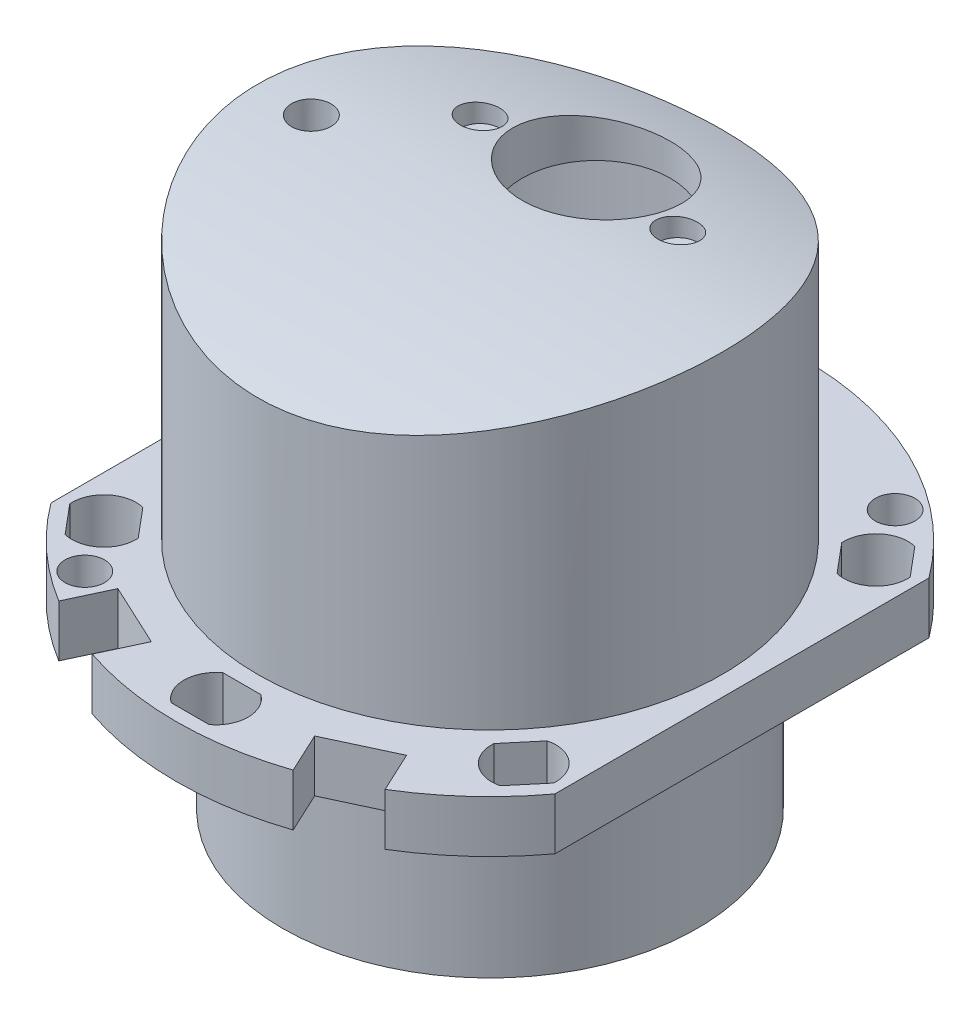
from build123d import *

# Parameters (mm, degrees)
BOSS_EXTRUDE1_DEPTH     = 5.25
CUT_EXTRUDE1_DEPTH      = 82.622208988
CUT_EXTRUDE1_DEPTH_BACK = 82.622208988
SKETCH2_R               = 4
SKETCH3_R               = 47
BOSS_EXTRUDE2_DEPTH     = 56.5
CUT_EXTRUDE4_DEPTH      = 103.213917839
CUT_EXTRUDE4_DEPTH_BACK = 103.213917839
SKETCH5_R               = 4
SKETCH5_R_2             = 15
CUT_EXTRUDE5_DEPTH      = 56.5
SKETCH6_R               = 42
BOSS_EXTRUDE3_DEPTH     = 36.5
CUT_EXTRUDE6_DEPTH      = 50.5
CUT_EXTRUDE6_DEPTH_BACK = 42.5
SKETCH7_R               = 39.5
SKETCH9_R               = 4.8
BOSS_EXTRUDE4_DEPTH     = 6
SKETCH10_R              = 2.2
CUT_EXTRUDE7_DEPTH      = 124.063743645
SKETCH11_R              = 4.8
CUT_EXTRUDE8_DEPTH      = 4
SKETCH12_R              = 4
CUT_EXTRUDE9_DEPTH      = 11
SKETCH13_R              = 3.5
CUT_EXTRUDE10_DEPTH     = 11.25


with BuildPart() as part:
    # Sketch1 → Boss-Extrude1 (new, symmetric)
    with BuildSketch(Plane(origin=(0, 0, 0), x_dir=(1, 0, 0), z_dir=(0, 1, 0))):
        with BuildLine():
            Line((-51, 37.85), (-51, -37.85))
            ThreePointArc((-51, -37.85), (0, -63.510806167), (51, -37.85))
            Line((51, -37.85), (51, 37.85))
            ThreePointArc((51, 37.85), (0, 63.510806167), (-51, 37.85))
        make_face()
    extrude(amount=BOSS_EXTRUDE1_DEPTH, both=True)

    # Sketch2 → Cut-Extrude1 (cut, two sides: drawn at the far end of the back side and taken through both)
    with BuildSketch(Plane(origin=(0, 0, 0), x_dir=(1, 0, 0), z_dir=(0, 1, 0)).offset(-CUT_EXTRUDE1_DEPTH_BACK)):
        with Locations(Location((35.603972242, 46.4, 0), (0, 0, 270))):
            Circle(SKETCH2_R)
        with Locations(Location((-35.603972242, -46.4, 0), (0, 0, 270))):
            Circle(SKETCH2_R)
        with BuildLine():
            Line((-3.832427429, 60.7), (3.832427429, 60.7))
            ThreePointArc((3.832427429, 60.7), (6.5, 55.45), (3.832427429, 50.2))
            Line((3.832427429, 50.2), (-3.832427429, 50.2))
            ThreePointArc((-3.832427429, 50.2), (-6.5, 55.45), (-3.832427429, 60.7))
        make_face()
        with BuildLine():
            Line((-35.991994178, 35.203747742), (-40.918867911, 29.33212827))
            ThreePointArc((-40.918867911, 29.33212827), (-46.655283834, 30.663284077), (-48.962334564, 36.081398172))
            Line((-48.962334564, 36.081398172), (-44.035460831, 41.953017644))
            ThreePointArc((-44.035460831, 41.953017644), (-38.299044908, 40.621861837), (-35.991994178, 35.203747742))
        make_face()
        with BuildLine():
            Line((48.962334564, 36.081398172), (44.035460831, 41.953017644))
            ThreePointArc((44.035460831, 41.953017644), (38.299044908, 40.621861837), (35.991994178, 35.203747742))
            Line((35.991994178, 35.203747742), (40.918867911, 29.33212827))
            ThreePointArc((40.918867911, 29.33212827), (46.655283834, 30.663284077), (48.962334564, 36.081398172))
        make_face()
        with BuildLine():
            Line((40.918867911, -29.33212827), (35.991994178, -35.203747742))
            ThreePointArc((35.991994178, -35.203747742), (38.299044908, -40.621861837), (44.035460831, -41.953017644))
            Line((44.035460831, -41.953017644), (48.962334564, -36.081398172))
            ThreePointArc((48.962334564, -36.081398172), (46.655283834, -30.663284077), (40.918867911, -29.33212827))
        make_face()
        with BuildLine():
            Line((-3.832427429, -50.2), (3.832427429, -50.2))
            ThreePointArc((3.832427429, -50.2), (6.5, -55.45), (3.832427429, -60.7))
            Line((3.832427429, -60.7), (-3.832427429, -60.7))
            ThreePointArc((-3.832427429, -60.7), (-6.5, -55.45), (-3.832427429, -50.2))
        make_face()
        with BuildLine():
            Line((-35.991994178, -35.203747742), (-40.918867911, -29.33212827))
            ThreePointArc((-40.918867911, -29.33212827), (-46.655283834, -30.663284077), (-48.962334564, -36.081398172))
            Line((-48.962334564, -36.081398172), (-44.035460831, -41.953017644))
            ThreePointArc((-44.035460831, -41.953017644), (-38.299044908, -40.621861837), (-35.991994178, -35.203747742))
        make_face()
        with BuildLine():
            Line((-29.217888815, -46.094553684), (-33.02145317, -54.251323767))
            ThreePointArc((-33.02145317, -54.251323767), (-26.840826504, -57.56033819), (-20.333144152, -60.167979432))
            Line((-20.333144152, -60.167979432), (-16.529579796, -52.011209348))
            Line((-16.529579796, -52.011209348), (-29.217888815, -46.094553684))
        make_face()
        with BuildLine():
            Line((20.333144152, -60.167979432), (16.529579796, -52.011209348))
            Line((16.529579796, -52.011209348), (29.217888815, -46.094553684))
            Line((29.217888815, -46.094553684), (33.02145317, -54.251323767))
            ThreePointArc((33.02145317, -54.251323767), (26.840826504, -57.56033819), (20.333144152, -60.167979432))
        make_face()
    extrude(amount=CUT_EXTRUDE1_DEPTH + CUT_EXTRUDE1_DEPTH_BACK, mode=Mode.SUBTRACT)

    # Sketch3 → Boss-Extrude2 (add)
    with BuildSketch(Plane(origin=(0, 5.25, 0), x_dir=(1, 0, 0), z_dir=(0, 1, 0))):
        with Locations(Location((0, 0, 0), (0, 0, 90))):
            Circle(SKETCH3_R)
    extrude(amount=BOSS_EXTRUDE2_DEPTH)

    # Sketch4 → Cut-Extrude4 (cut, two sides: drawn at the far end of the back side and taken through both)
    with BuildSketch(Plane(origin=(0, 0, 0), x_dir=(0, 0, -1), z_dir=(1, 0, 0)).offset(-CUT_EXTRUDE4_DEPTH_BACK)):
        with BuildLine():
            Line((-47, 53.746268605), (-47, 76.557383468))
            Line((-47, 76.557383468), (47, 76.557383468))
            Line((47, 76.557383468), (47, 53.746268605))
            ThreePointArc((47, 53.746268605), (0, 61.75), (-47, 53.746268605))
        make_face()
    extrude(amount=CUT_EXTRUDE4_DEPTH + CUT_EXTRUDE4_DEPTH_BACK, mode=Mode.SUBTRACT)

    # Sketch5 → Cut-Extrude5 (cut)
    with BuildSketch(Plane(origin=(0, 5.25, 0), x_dir=(1, 0, 0), z_dir=(0, 1, 0))):
        with Locations(Location((20, 18, 0), (0, 0, 90))):
            Circle(SKETCH5_R)
        with Locations(Location((-20, 18, 0), (0, 0, 90))):
            Circle(SKETCH5_R)
        with Locations(Location((0, 21.5, 0), (0, 0, 90))):
            Circle(SKETCH5_R_2)
    extrude(amount=CUT_EXTRUDE5_DEPTH, mode=Mode.SUBTRACT)

    # Sketch6 → Boss-Extrude3 (add)
    with BuildSketch(Plane(origin=(0, -5.25, 0), x_dir=(-1, 0, 0), z_dir=(0, -1, 0))):
        with Locations(Location((0, 0, 0), (0, 0, 90))):
            Circle(SKETCH6_R)
    extrude(amount=BOSS_EXTRUDE3_DEPTH)

    # Sketch7 → Cut-Extrude6 (cut, two sides: drawn at the far end of the back side and taken through both)
    with BuildSketch(Plane(origin=(0, 0, 0), x_dir=(1, 0, 0), z_dir=(0, 1, 0)).offset(-CUT_EXTRUDE6_DEPTH_BACK)):
        with Locations(Location((0, 0, 0), (0, 0, 90))):
            Circle(SKETCH7_R)
    extrude(amount=CUT_EXTRUDE6_DEPTH + CUT_EXTRUDE6_DEPTH_BACK, mode=Mode.SUBTRACT)

    # Sketch9 → Boss-Extrude4 (add)
    with BuildSketch(Plane(origin=(0, 50.5, 0), x_dir=(-1, 0, 0), z_dir=(0, -1, 0))):
        with Locations((-20, 18)):
            Circle(SKETCH9_R)
        with Locations((20, 18)):
            Circle(SKETCH9_R)
    extrude(amount=-BOSS_EXTRUDE4_DEPTH)

    # Sketch10 → Cut-Extrude7 (cut, through all)
    with BuildSketch(Plane(origin=(0, 50.5, 0), x_dir=(-1, 0, 0), z_dir=(0, -1, 0))):
        with Locations(Location((-20, 18, 0), (0, 0, 90))):
            Circle(SKETCH10_R)
        with Locations(Location((20, 18, 0), (0, 0, 270))):
            Circle(SKETCH10_R)
    extrude(amount=-CUT_EXTRUDE7_DEPTH, mode=Mode.SUBTRACT)

    # Sketch11 → Cut-Extrude8 (cut)
    with BuildSketch(Plane(origin=(0, 50.5, 0), x_dir=(-1, 0, 0), z_dir=(0, -1, 0))):
        with Locations(Location((-20, 18, 0), (0, 0, 90))):
            Circle(SKETCH11_R)
        with Locations(Location((20, 18, 0), (0, 0, 270))):
            Circle(SKETCH11_R)
    extrude(amount=-CUT_EXTRUDE8_DEPTH, mode=Mode.SUBTRACT)

    # Sketch12 → Cut-Extrude9 (cut)
    with BuildSketch(Plane(origin=(0, 61.75, 0), x_dir=(1, 0, 0), z_dir=(0, 1, 0))):
        with Locations(Location((-36.15, 0, 0), (0, 0, 270))):
            Circle(SKETCH12_R)
    extrude(amount=-CUT_EXTRUDE9_DEPTH, mode=Mode.SUBTRACT)

    # Sketch13 → Cut-Extrude10 (cut)
    with BuildSketch(Plane(origin=(0, 61.75, 0), x_dir=(1, 0, 0), z_dir=(0, 1, 0))):
        with Locations(Location((-36.15, 0, 0), (0, 0, 270))):
            Circle(SKETCH13_R)
    extrude(amount=-CUT_EXTRUDE10_DEPTH, mode=Mode.SUBTRACT)


solid = part.part
